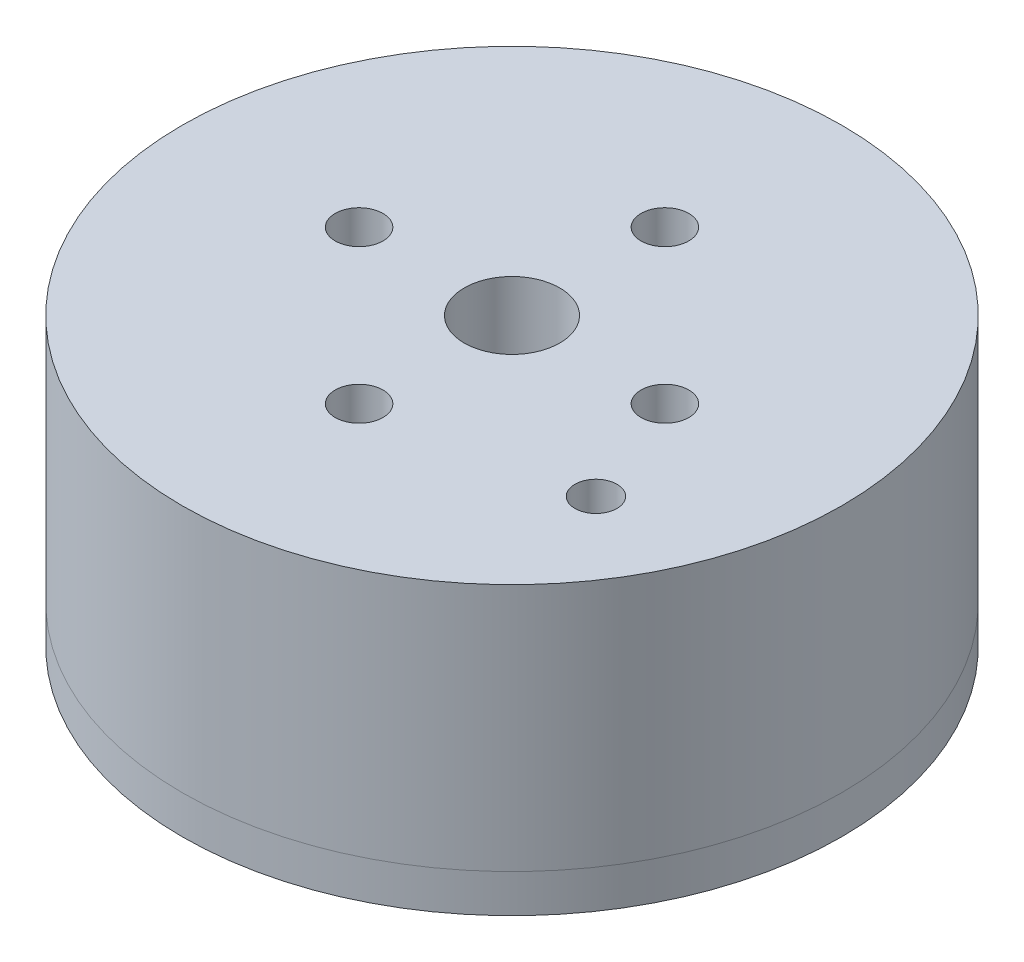
from build123d import *

# Parameters (mm, degrees)
SKETCH_1_R        = 17.25
SKETCH_1_R_2      = 2.5
SKETCH_1_R_3      = 1.25
SKETCH_1_R_4      = 1.1
EXTRUDE_1_DEPTH   = 13
SKETCH_2_R        = 17.25
SKETCH_2_R_2      = 1.25
SKETCH_2_R_3      = 4.5
EXTRUDE_3_DEPTH   = 2
SKETCH_3_R        = 2.65
SKETCH_3_R_2      = 2.35
EXTRUDE_1_2_DEPTH = 2


with BuildPart() as part:
    # 草图1 → Extrude 1 (new body)
    with BuildSketch(Plane(origin=(0, 0, 0), x_dir=(1, 0, 0), z_dir=(0, 1, 0))):
        with Locations(Location((0, 0, 0), (0, 0, 270))):
            Circle(SKETCH_1_R)
        with Locations(Location((0, 0, 0), (0, 0, 270))):
            Circle(SKETCH_1_R_2, mode=Mode.SUBTRACT)
        with Locations(Location((8, 0, 0), (0, 0, 270))):
            Circle(SKETCH_1_R_3, mode=Mode.SUBTRACT)
        with Locations(Location((0, -8, 0), (0, 0, 270))):
            Circle(SKETCH_1_R_3, mode=Mode.SUBTRACT)
        with Locations(Location((-8, 0, 0), (0, 0, 270))):
            Circle(SKETCH_1_R_3, mode=Mode.SUBTRACT)
        with Locations(Location((0, 8, 0), (0, 0, 270))):
            Circle(SKETCH_1_R_3, mode=Mode.SUBTRACT)
        with Locations(Location((10.392304845, -6, 0), (0, 0, 270))):
            Circle(SKETCH_1_R_4, mode=Mode.SUBTRACT)
    extrude(amount=-EXTRUDE_1_DEPTH)

    # 草图3 → Extrude 1 2 (add)
    with BuildSketch(Plane.XZ.offset(13)):
        Circle(SKETCH_3_R)
        Circle(SKETCH_3_R_2, mode=Mode.SUBTRACT)
    extrude(amount=EXTRUDE_1_2_DEPTH)


with BuildPart() as body_2:
    # 草图2 → 凸台-拉伸3 (new body)
    with BuildSketch(Plane.XZ.offset(13)):
        with Locations(Location((0, 0, 0), (0, 0, 270))):
            Circle(SKETCH_2_R)
        with Locations(Location((6.7, 6.7, 0), (0, 0, 270))):
            Circle(SKETCH_2_R_2, mode=Mode.SUBTRACT)
        with Locations(Location((6.7, -6.7, 0), (0, 0, 270))):
            Circle(SKETCH_2_R_2, mode=Mode.SUBTRACT)
        with Locations(Location((-6.7, -6.7, 0), (0, 0, 270))):
            Circle(SKETCH_2_R_2, mode=Mode.SUBTRACT)
        with Locations(Location((-6.7, 6.7, 0), (0, 0, 270))):
            Circle(SKETCH_2_R_2, mode=Mode.SUBTRACT)
        with Locations(Location((0, 0, 0), (0, 0, 270))):
            Circle(SKETCH_2_R_3, mode=Mode.SUBTRACT)
    extrude(amount=EXTRUDE_3_DEPTH)


solid = Compound([part.part, body_2.part])
